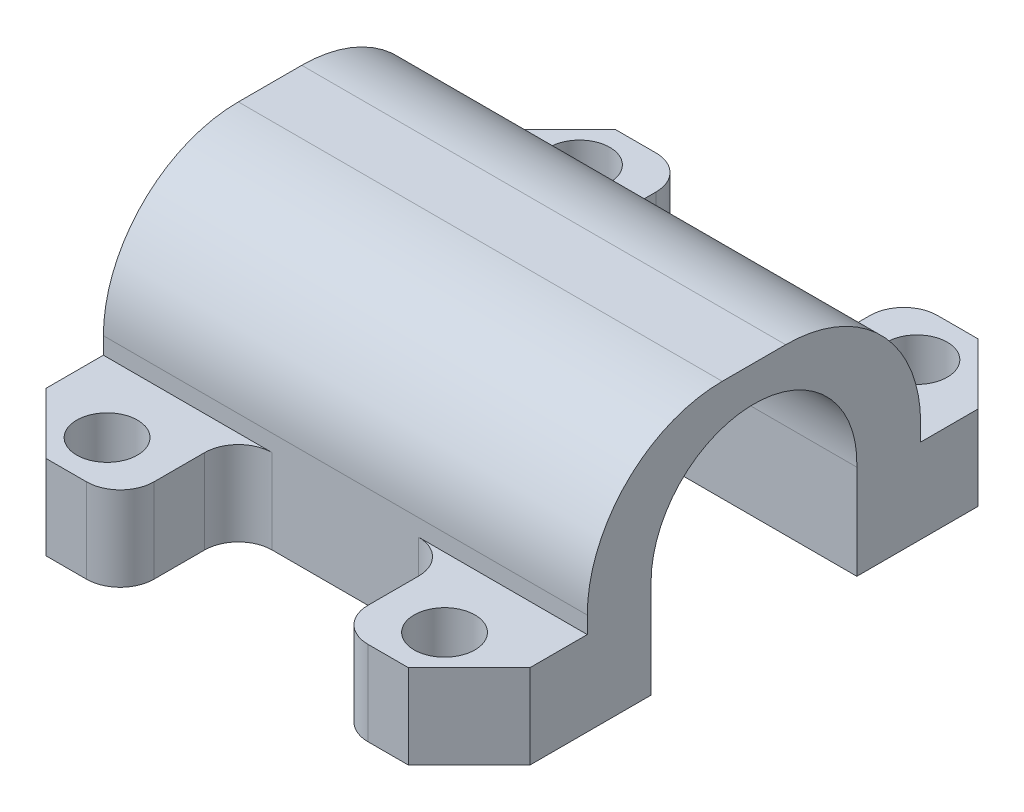
from build123d import *

# Parameters (mm, degrees)
BOSS_EXTRUDE1_DEPTH = 2.5
SKETCH2_R           = 0.9
CUT_EXTRUDE1_DEPTH  = 2.5
SKETCH3_W           = 14.34
SKETCH3_H           = 9.878404361
BOSS_EXTRUDE2_DEPTH = 4.5
SKETCH4_R           = 3.05
CUT_EXTRUDE2_DEPTH  = 57.133646482
SKETCH5_W           = 6.098404361
SKETCH5_H           = 2.9
CUT_EXTRUDE3_DEPTH  = 57.133646482
FILLET1_R           = 4
SKETCH7_W           = 6.34
SKETCH7_H           = 3.5
CUT_EXTRUDE5_DEPTH  = 61.145372561
FILLET2_R           = 1


with BuildPart() as part:
    # Sketch1 → Boss-Extrude1 (new body)
    with BuildSketch(Plane(origin=(0, 0, 0), x_dir=(1, 0, 0), z_dir=(0, 1, 0))):
        Polygon((26.473858297, -52.017754202), (24.673858297, -53.817754202), (13.933858297, -53.817754202), (12.133858297, -52.017754202), (12.133858297, -38.739349841), (13.933858297, -36.939349841), (24.673858297, -36.939349841), (26.473858297, -38.739349841), align=None)
    extrude(amount=BOSS_EXTRUDE1_DEPTH)

    # Sketch2 → Cut-Extrude1 (cut)
    with BuildSketch(Plane(origin=(0, 2.5, 0), x_dir=(1, 0, 0), z_dir=(0, 1, 0))):
        with Locations(Location((24.303858297, -52.377754202, 0), (0, 0, 270))):
            Circle(SKETCH2_R)
        with Locations(Location((14.303858297, -52.377754202, 0), (0, 0, 270))):
            Circle(SKETCH2_R)
        with Locations(Location((14.303858297, -38.379349841, 0), (0, 0, 270))):
            Circle(SKETCH2_R)
        with Locations(Location((24.303858297, -38.379349841, 0), (0, 0, 270))):
            Circle(SKETCH2_R)
    extrude(amount=-CUT_EXTRUDE1_DEPTH, mode=Mode.SUBTRACT)

    # Sketch3 → Boss-Extrude2 (add)
    with BuildSketch(Plane(origin=(0, 2.5, 0), x_dir=(1, 0, 0), z_dir=(0, 1, 0))):
        with Locations((19.303858297, -45.378552021)):
            Rectangle(SKETCH3_W, SKETCH3_H)
    extrude(amount=BOSS_EXTRUDE2_DEPTH)

    # Sketch4 → Cut-Extrude2 (cut, through all)
    with BuildSketch(Plane.ZY.offset(-12.133858297)):
        with Locations((45.377754202, 2.9)):
            Circle(SKETCH4_R)
    extrude(amount=-CUT_EXTRUDE2_DEPTH, mode=Mode.SUBTRACT)

    # Sketch5 → Cut-Extrude3 (cut, through all)
    with BuildSketch(Plane.ZY.offset(-12.133858297)):
        with Locations((45.378552021, 1.45)):
            Rectangle(SKETCH5_W, SKETCH5_H)
    extrude(amount=-CUT_EXTRUDE3_DEPTH, mode=Mode.SUBTRACT)

    # Fillet1
    fillet1_edges = [part.edges().sort_by_distance(p)[0] for p in [
        (19.303858297, 7, 40.439349841),
        (19.303858297, 7, 50.317754202),
    ]]
    fillet(fillet1_edges, radius=FILLET1_R)

    # Sketch7 → Cut-Extrude5 (cut, through all)
    with BuildSketch(Plane(origin=(0, 2.5, 0), x_dir=(1, 0, 0), z_dir=(0, 1, 0))):
        with Locations((19.303858297, -52.067754202)):
            Rectangle(SKETCH7_W, SKETCH7_H)
        with Locations((19.303858297, -38.689349841)):
            Rectangle(SKETCH7_W, SKETCH7_H)
    extrude(amount=-CUT_EXTRUDE5_DEPTH, mode=Mode.SUBTRACT)

    # Fillet2
    fillet2_edges = [part.edges().sort_by_distance(p)[0] for p in [
        (22.473858297, 1.25, 50.317754202),
        (22.473858297, 1.25, 53.817754202),
        (16.133858297, 1.25, 53.817754202),
        (16.133858297, 1.25, 50.317754202),
        (22.473858297, 1.25, 36.939349841),
        (22.473858297, 1.25, 40.439349841),
        (16.133858297, 1.25, 40.439349841),
        (16.133858297, 1.25, 36.939349841),
    ]]
    fillet(fillet2_edges, radius=FILLET2_R)


solid = part.part
